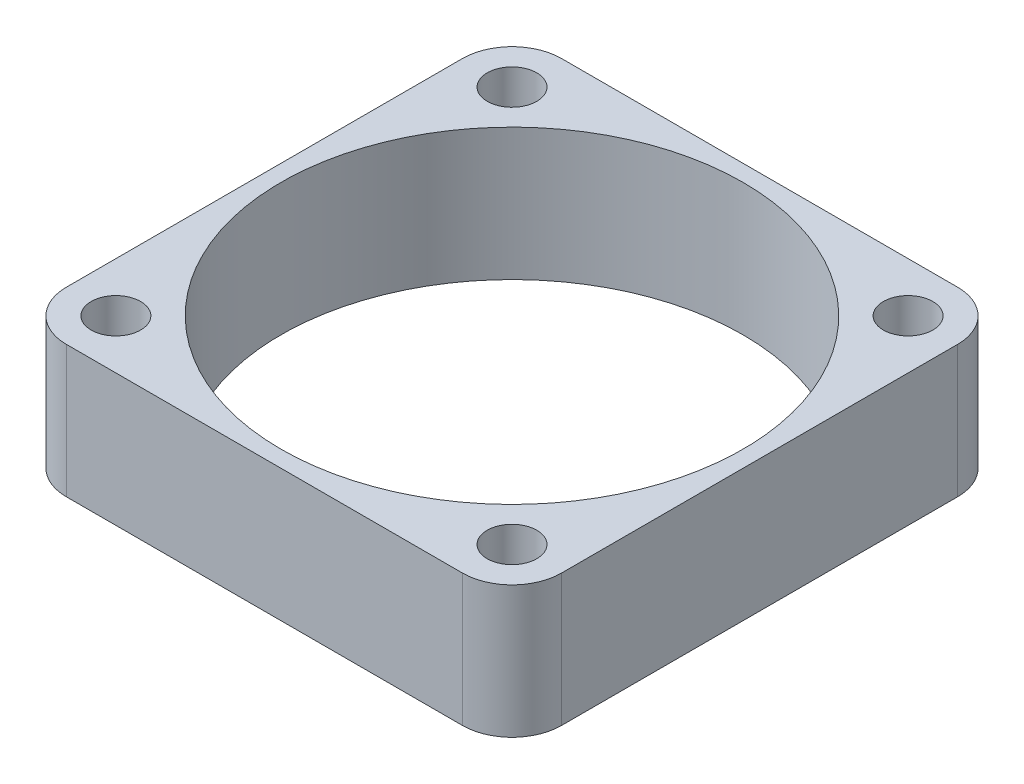
from build123d import *

# Parameters (mm, degrees)
SKETCH1_W           = 30
SKETCH1_H           = 30
SKETCH1_R           = 1.5
SKETCH1_R_2         = 14
BOSS_EXTRUDE1_DEPTH = 8
FILLET1_R           = 3


with BuildPart() as part:
    # Sketch1 → Boss-Extrude1 (new body)
    with BuildSketch(Plane(origin=(0, 0, 0), x_dir=(1, 0, 0), z_dir=(0, 1, 0))):
        Rectangle(SKETCH1_W, SKETCH1_H)
        with Locations(Location((12, 12, 0), (0, 0, 270))):
            Circle(SKETCH1_R, mode=Mode.SUBTRACT)
        with Locations(Location((-12, 12, 0), (0, 0, 270))):
            Circle(SKETCH1_R, mode=Mode.SUBTRACT)
        with Locations(Location((-12, -12, 0), (0, 0, 270))):
            Circle(SKETCH1_R, mode=Mode.SUBTRACT)
        with Locations(Location((12, -12, 0), (0, 0, 270))):
            Circle(SKETCH1_R, mode=Mode.SUBTRACT)
        with Locations(Location((0, 0, 0), (0, 0, 270))):
            Circle(SKETCH1_R_2, mode=Mode.SUBTRACT)
    extrude(amount=BOSS_EXTRUDE1_DEPTH)

    # Fillet1
    fillet1_edges = [part.edges().sort_by_distance(p)[0] for p in [
        (15, 4, 15),
        (-15, 4, 15),
        (-15, 4, -15),
        (15, 4, -15),
    ]]
    fillet(fillet1_edges, radius=FILLET1_R)


solid = part.part
